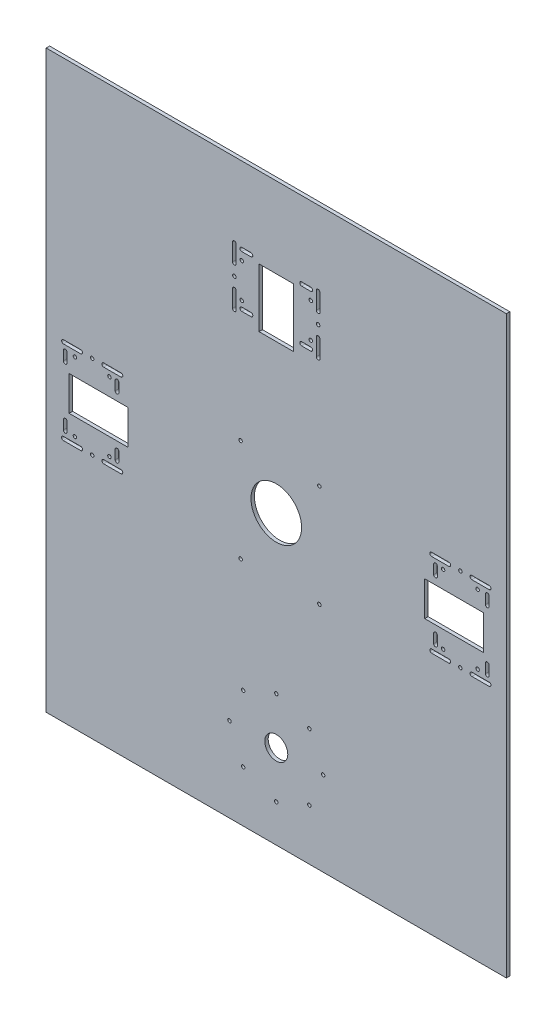
from build123d import *

# Parameters (mm, degrees)
SKETCH_1_W          = 400
SKETCH_1_H          = 500
SKETCH_1_R          = 1.5
SKETCH_1_R_2        = 22
SKETCH_1_R_3        = 10
SKETCH_1_W_2        = 30
SKETCH_1_H_2        = 51
SKETCH_1_W_3        = 51
SKETCH_1_H_3        = 30
EXTRUDE_1_DEPTH     = 3
SKETCH_2_R          = 1.5
CUT_EXTRUDE_1_DEPTH = 321.170267202


with BuildPart() as part:
    # 草图1 → 凸台-拉伸1 (new body)
    with BuildSketch(Plane.XY):
        Rectangle(SKETCH_1_W, SKETCH_1_H)
        with Locations((-36.4, 160)):
            Circle(SKETCH_1_R, mode=Mode.SUBTRACT)
        with Locations((-30, 145)):
            Circle(SKETCH_1_R, mode=Mode.SUBTRACT)
        with Locations((-30, 175)):
            Circle(SKETCH_1_R, mode=Mode.SUBTRACT)
        with Locations((36.4, 160)):
            Circle(SKETCH_1_R, mode=Mode.SUBTRACT)
        with Locations((30, 175)):
            Circle(SKETCH_1_R, mode=Mode.SUBTRACT)
        with Locations((30, 145)):
            Circle(SKETCH_1_R, mode=Mode.SUBTRACT)
        with Locations((160, -36.4)):
            Circle(SKETCH_1_R, mode=Mode.SUBTRACT)
        with Locations((145, -30)):
            Circle(SKETCH_1_R, mode=Mode.SUBTRACT)
        with Locations((175, -30)):
            Circle(SKETCH_1_R, mode=Mode.SUBTRACT)
        with Locations((160, 36.4)):
            Circle(SKETCH_1_R, mode=Mode.SUBTRACT)
        with Locations((175, 30)):
            Circle(SKETCH_1_R, mode=Mode.SUBTRACT)
        with Locations((145, 30)):
            Circle(SKETCH_1_R, mode=Mode.SUBTRACT)
        with Locations((-160, 36.4)):
            Circle(SKETCH_1_R, mode=Mode.SUBTRACT)
        with Locations((-145, 30)):
            Circle(SKETCH_1_R, mode=Mode.SUBTRACT)
        with Locations((-175, 30)):
            Circle(SKETCH_1_R, mode=Mode.SUBTRACT)
        with Locations((-160, -36.4)):
            Circle(SKETCH_1_R, mode=Mode.SUBTRACT)
        with Locations((-175, -30)):
            Circle(SKETCH_1_R, mode=Mode.SUBTRACT)
        with Locations((-145, -30)):
            Circle(SKETCH_1_R, mode=Mode.SUBTRACT)
        Circle(SKETCH_1_R_2, mode=Mode.SUBTRACT)
        with Locations((0, -176.690492226)):
            Circle(SKETCH_1_R_3, mode=Mode.SUBTRACT)
        with Locations((0, -135.985304682)):
            Circle(SKETCH_1_R, mode=Mode.SUBTRACT)
        with Locations((28.782914142, -147.907578084)):
            Circle(SKETCH_1_R, mode=Mode.SUBTRACT)
        with Locations((40.705187545, -176.690492226)):
            Circle(SKETCH_1_R, mode=Mode.SUBTRACT)
        with Locations((28.782914142, -205.473406369)):
            Circle(SKETCH_1_R, mode=Mode.SUBTRACT)
        with Locations((0, -217.395679771)):
            Circle(SKETCH_1_R, mode=Mode.SUBTRACT)
        with Locations((-28.782914142, -205.473406369)):
            Circle(SKETCH_1_R, mode=Mode.SUBTRACT)
        with Locations((-40.705187545, -176.690492226)):
            Circle(SKETCH_1_R, mode=Mode.SUBTRACT)
        with Locations((-28.782914142, -147.907578084)):
            Circle(SKETCH_1_R, mode=Mode.SUBTRACT)
        with BuildLine():
            Line((-34.8, 185), (-34.8, 170))
            ThreePointArc((-34.8, 170), (-36.4, 168.4), (-38, 170))
            Line((-38, 170), (-38, 185))
            ThreePointArc((-38, 185), (-36.4, 186.6), (-34.8, 185))
        make_face(mode=Mode.SUBTRACT)
        with BuildLine():
            Line((-38, 135), (-38, 150))
            ThreePointArc((-38, 150), (-36.4, 151.6), (-34.8, 150))
            Line((-34.8, 150), (-34.8, 135))
            ThreePointArc((-34.8, 135), (-36.4, 133.4), (-38, 135))
        make_face(mode=Mode.SUBTRACT)
        with BuildLine():
            Line((-22, 181.8), (-30, 181.8))
            ThreePointArc((-30, 181.8), (-31.6, 183.4), (-30, 185))
            Line((-30, 185), (-22, 185))
            ThreePointArc((-22, 185), (-20.4, 183.4), (-22, 181.8))
        make_face(mode=Mode.SUBTRACT)
        with BuildLine():
            Line((-30, 140), (-22, 140))
            ThreePointArc((-22, 140), (-20.4, 138.4), (-22, 136.8))
            Line((-22, 136.8), (-30, 136.8))
            ThreePointArc((-30, 136.8), (-31.6, 138.4), (-30, 140))
        make_face(mode=Mode.SUBTRACT)
        with BuildLine():
            Line((30, 140), (22, 140))
            ThreePointArc((22, 140), (20.4, 138.4), (22, 136.8))
            Line((22, 136.8), (30, 136.8))
            ThreePointArc((30, 136.8), (31.6, 138.4), (30, 140))
        make_face(mode=Mode.SUBTRACT)
        with BuildLine():
            Line((38, 135), (38, 150))
            ThreePointArc((38, 150), (36.4, 151.6), (34.8, 150))
            Line((34.8, 150), (34.8, 135))
            ThreePointArc((34.8, 135), (36.4, 133.4), (38, 135))
        make_face(mode=Mode.SUBTRACT)
        with BuildLine():
            Line((34.8, 185), (34.8, 170))
            ThreePointArc((34.8, 170), (36.4, 168.4), (38, 170))
            Line((38, 170), (38, 185))
            ThreePointArc((38, 185), (36.4, 186.6), (34.8, 185))
        make_face(mode=Mode.SUBTRACT)
        with BuildLine():
            Line((22, 181.8), (30, 181.8))
            ThreePointArc((30, 181.8), (31.6, 183.4), (30, 185))
            Line((30, 185), (22, 185))
            ThreePointArc((22, 185), (20.4, 183.4), (22, 181.8))
        make_face(mode=Mode.SUBTRACT)
        with Locations((0, 154.5)):
            Rectangle(SKETCH_1_W_2, SKETCH_1_H_2, mode=Mode.SUBTRACT)
        with Locations((154.5, 0)):
            Rectangle(SKETCH_1_W_3, SKETCH_1_H_3, mode=Mode.SUBTRACT)
        with BuildLine():
            Line((185, 34.8), (170, 34.8))
            ThreePointArc((170, 34.8), (168.4, 36.4), (170, 38))
            Line((170, 38), (185, 38))
            ThreePointArc((185, 38), (186.6, 36.4), (185, 34.8))
        make_face(mode=Mode.SUBTRACT)
        with BuildLine():
            Line((135, 38), (150, 38))
            ThreePointArc((150, 38), (151.6, 36.4), (150, 34.8))
            Line((150, 34.8), (135, 34.8))
            ThreePointArc((135, 34.8), (133.4, 36.4), (135, 38))
        make_face(mode=Mode.SUBTRACT)
        with BuildLine():
            Line((181.8, 22), (181.8, 30))
            ThreePointArc((181.8, 30), (183.4, 31.6), (185, 30))
            Line((185, 30), (185, 22))
            ThreePointArc((185, 22), (183.4, 20.4), (181.8, 22))
        make_face(mode=Mode.SUBTRACT)
        with BuildLine():
            Line((140, 30), (140, 22))
            ThreePointArc((140, 22), (138.4, 20.4), (136.8, 22))
            Line((136.8, 22), (136.8, 30))
            ThreePointArc((136.8, 30), (138.4, 31.6), (140, 30))
        make_face(mode=Mode.SUBTRACT)
        with BuildLine():
            Line((140, -30), (140, -22))
            ThreePointArc((140, -22), (138.4, -20.4), (136.8, -22))
            Line((136.8, -22), (136.8, -30))
            ThreePointArc((136.8, -30), (138.4, -31.6), (140, -30))
        make_face(mode=Mode.SUBTRACT)
        with BuildLine():
            Line((135, -38), (150, -38))
            ThreePointArc((150, -38), (151.6, -36.4), (150, -34.8))
            Line((150, -34.8), (135, -34.8))
            ThreePointArc((135, -34.8), (133.4, -36.4), (135, -38))
        make_face(mode=Mode.SUBTRACT)
        with BuildLine():
            Line((185, -34.8), (170, -34.8))
            ThreePointArc((170, -34.8), (168.4, -36.4), (170, -38))
            Line((170, -38), (185, -38))
            ThreePointArc((185, -38), (186.6, -36.4), (185, -34.8))
        make_face(mode=Mode.SUBTRACT)
        with BuildLine():
            Line((181.8, -22), (181.8, -30))
            ThreePointArc((181.8, -30), (183.4, -31.6), (185, -30))
            Line((185, -30), (185, -22))
            ThreePointArc((185, -22), (183.4, -20.4), (181.8, -22))
        make_face(mode=Mode.SUBTRACT)
        with Locations((-154.5, 0)):
            Rectangle(SKETCH_1_W_3, SKETCH_1_H_3, mode=Mode.SUBTRACT)
        with BuildLine():
            Line((-185, -34.8), (-170, -34.8))
            ThreePointArc((-170, -34.8), (-168.4, -36.4), (-170, -38))
            Line((-170, -38), (-185, -38))
            ThreePointArc((-185, -38), (-186.6, -36.4), (-185, -34.8))
        make_face(mode=Mode.SUBTRACT)
        with BuildLine():
            Line((-135, -38), (-150, -38))
            ThreePointArc((-150, -38), (-151.6, -36.4), (-150, -34.8))
            Line((-150, -34.8), (-135, -34.8))
            ThreePointArc((-135, -34.8), (-133.4, -36.4), (-135, -38))
        make_face(mode=Mode.SUBTRACT)
        with BuildLine():
            Line((-181.8, -22), (-181.8, -30))
            ThreePointArc((-181.8, -30), (-183.4, -31.6), (-185, -30))
            Line((-185, -30), (-185, -22))
            ThreePointArc((-185, -22), (-183.4, -20.4), (-181.8, -22))
        make_face(mode=Mode.SUBTRACT)
        with BuildLine():
            Line((-140, -30), (-140, -22))
            ThreePointArc((-140, -22), (-138.4, -20.4), (-136.8, -22))
            Line((-136.8, -22), (-136.8, -30))
            ThreePointArc((-136.8, -30), (-138.4, -31.6), (-140, -30))
        make_face(mode=Mode.SUBTRACT)
        with BuildLine():
            Line((-140, 30), (-140, 22))
            ThreePointArc((-140, 22), (-138.4, 20.4), (-136.8, 22))
            Line((-136.8, 22), (-136.8, 30))
            ThreePointArc((-136.8, 30), (-138.4, 31.6), (-140, 30))
        make_face(mode=Mode.SUBTRACT)
        with BuildLine():
            Line((-135, 38), (-150, 38))
            ThreePointArc((-150, 38), (-151.6, 36.4), (-150, 34.8))
            Line((-150, 34.8), (-135, 34.8))
            ThreePointArc((-135, 34.8), (-133.4, 36.4), (-135, 38))
        make_face(mode=Mode.SUBTRACT)
        with BuildLine():
            Line((-185, 34.8), (-170, 34.8))
            ThreePointArc((-170, 34.8), (-168.4, 36.4), (-170, 38))
            Line((-170, 38), (-185, 38))
            ThreePointArc((-185, 38), (-186.6, 36.4), (-185, 34.8))
        make_face(mode=Mode.SUBTRACT)
        with BuildLine():
            Line((-181.8, 22), (-181.8, 30))
            ThreePointArc((-181.8, 30), (-183.4, 31.6), (-185, 30))
            Line((-185, 30), (-185, 22))
            ThreePointArc((-185, 22), (-183.4, 20.4), (-181.8, 22))
        make_face(mode=Mode.SUBTRACT)
    extrude(amount=EXTRUDE_1_DEPTH)

    # 草图2 → 切除-拉伸1 (cut, through all)
    with BuildSketch(Plane.XY.offset(3)):
        with Locations((-31, 39.03)):
            Circle(SKETCH_2_R)
        with Locations((37.45, 39.03)):
            Circle(SKETCH_2_R)
        with Locations((-31, -50)):
            Circle(SKETCH_2_R)
        with Locations((37.45, -50)):
            Circle(SKETCH_2_R)
    extrude(amount=-CUT_EXTRUDE_1_DEPTH, mode=Mode.SUBTRACT)


solid = part.part
